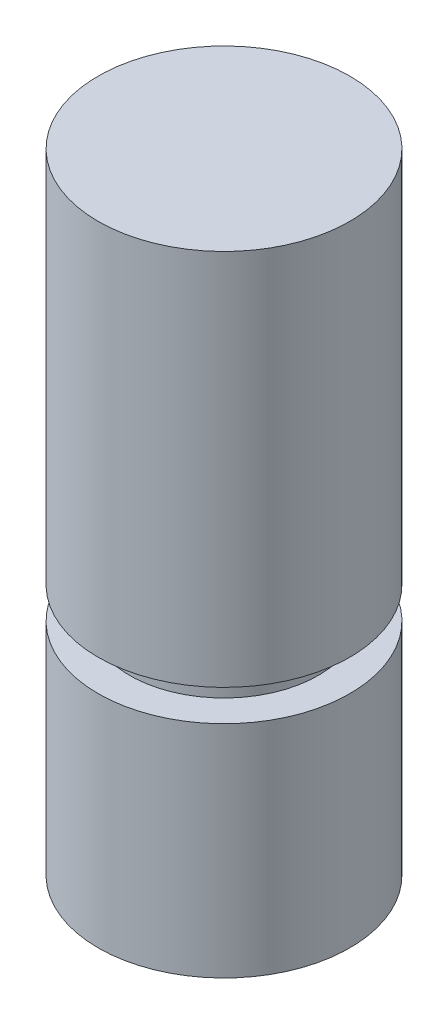
from build123d import *

# Parameters (mm, degrees)
SKETCH1_R           = 2
BOSS_EXTRUDE1_DEPTH = 10
SKETCH2_W           = 0.5
SKETCH2_H           = 0.5


with BuildPart() as part:
    # Sketch1 → Boss-Extrude1 (new body)
    with BuildSketch(Plane(origin=(0, 0, 0), x_dir=(1, 0, 0), z_dir=(0, 1, 0))):
        with Locations(Location((0, 0, 0), (0, 0, 270))):
            Circle(SKETCH1_R)
    extrude(amount=BOSS_EXTRUDE1_DEPTH)

    # Sketch2 → Cut-Revolve1 (revolve, cut)
    with BuildSketch(Plane.XY, mode=Mode.PRIVATE) as cut_revolve1_sk:
        with Locations((1.75, 3.75)):
            Rectangle(SKETCH2_W, SKETCH2_H)
    revolve(cut_revolve1_sk.sketch.rotate(Axis((0, 0, 0), (0, 1, 0)), 90), axis=Axis((0, 0, 0), (0, 1, 0)), mode=Mode.SUBTRACT)


solid = part.part
